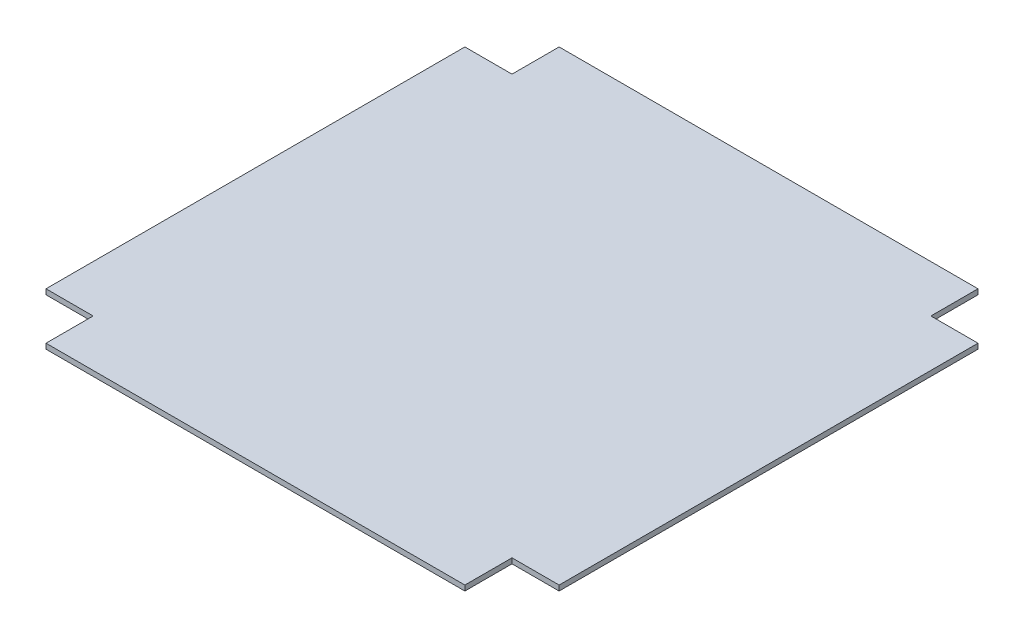
from build123d import *

# Parameters (mm, degrees)
BOSS_EXTRU_1_DEPTH = 5


with BuildPart() as part:
    # Esquisse1 → Boss.-Extru.1 (new body)
    with BuildSketch(Plane(origin=(0, 0, 0), x_dir=(1, 0, 0), z_dir=(0, 1, 0))):
        Polygon((-245, 200), (-200, 200), (-200, 245), (0, 245), (200, 245), (200, 200), (245, 200), (245, 0), (245, -200), (200, -200), (200, -245), (0, -245), (-200, -245), (-200, -200), (-245, -200), (-245, 0), align=None)
    extrude(amount=BOSS_EXTRU_1_DEPTH)


solid = part.part
